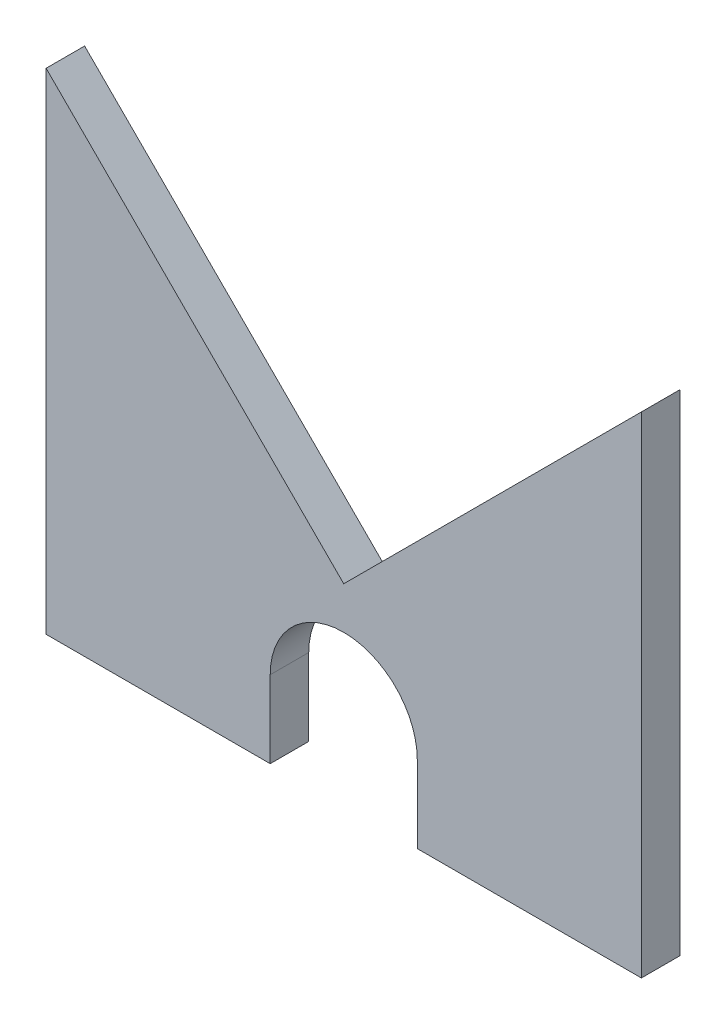
from build123d import *

# Parameters (mm, degrees)
BOSS_EXTRUDE1_DEPTH = 2.2


with BuildPart() as part:
    # Sketch1 → Boss-Extrude1 (new body)
    with BuildSketch(Plane.XY):
        with BuildLine():
            Line((17, 11), (0, 28))
            Line((0, 28), (0, 0))
            Line((0, 0), (12.8, 0))
            Line((12.8, 0), (12.8, 4.4))
            ThreePointArc((12.8, 4.4), (17, 8.6), (21.2, 4.4))
            Line((21.2, 4.4), (21.2, 0))
            Line((21.2, 0), (34, 0))
            Line((34, 0), (34, 28))
            Line((34, 28), (17, 11))
        make_face()
    extrude(amount=BOSS_EXTRUDE1_DEPTH)


solid = part.part
